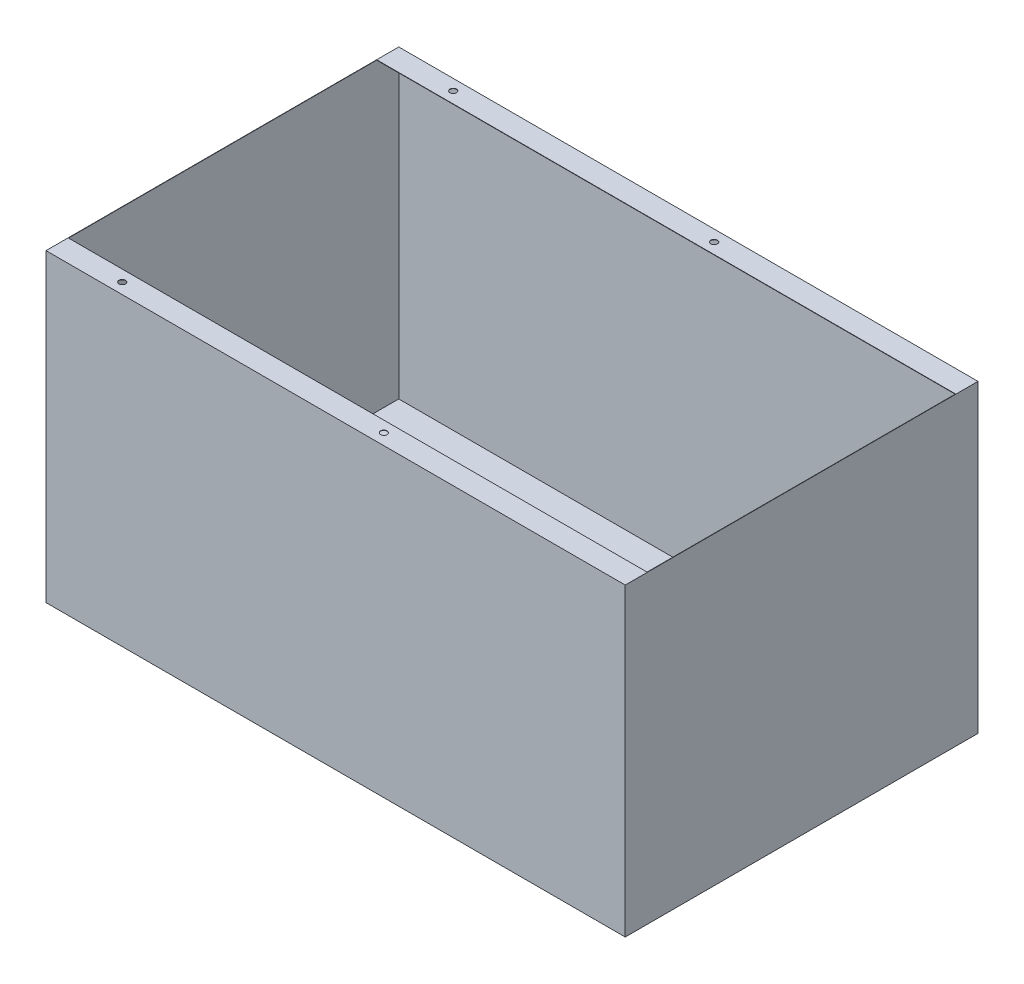
from build123d import *

# Parameters (mm, degrees)
SKETCH1_W           = 2057.4
SKETCH1_H           = 1778
BOSS_EXTRUDE1_DEPTH = 3378.2
SKETCH2_W           = 3374.19999784
SKETCH2_H           = 2053.39999784
CUT_EXTRUDE1_DEPTH  = 1775.99999892
SKETCH3_W           = 3374.19999784
SKETCH3_H           = 2.00000108
BOSS_EXTRUDE2_DEPTH = 127
SKETCH4_W           = 3374.19999784
SKETCH4_H           = 2.00000108
BOSS_EXTRUDE3_DEPTH = 127
CUT_EXTRUDE2_REACH  = 4338.636
SKETCH5_R           = 19.05
SCALE1_SCALE        = 2.54


with BuildPart() as part:
    # Sketch1 → Boss-Extrude1 (new body)
    with BuildSketch(Plane(origin=(0, 0, 0), x_dir=(0, 0, -1), z_dir=(1, 0, 0))):
        with Locations((1028.7, 889)):
            Rectangle(SKETCH1_W, SKETCH1_H)
    extrude(amount=-BOSS_EXTRUDE1_DEPTH)

    # Sketch2 → Cut-Extrude1 (cut)
    with BuildSketch(Plane(origin=(0, 1778, 0), x_dir=(1, 0, 0), z_dir=(0, 1, 0))):
        with Locations((-1689.1, 1028.7)):
            Rectangle(SKETCH2_W, SKETCH2_H)
    extrude(amount=-CUT_EXTRUDE1_DEPTH, mode=Mode.SUBTRACT)

    # Sketch3 → Boss-Extrude2 (add)
    with BuildSketch(Plane.XY.offset(-2055.39999892)):
        with Locations((-1689.1, 1776.99999946)):
            Rectangle(SKETCH3_W, SKETCH3_H)
    extrude(amount=BOSS_EXTRUDE2_DEPTH)

    # Sketch4 → Boss-Extrude3 (add)
    with BuildSketch(Plane(origin=(0, 0, -2.00000108), x_dir=(-1, 0, 0), z_dir=(0, 0, -1))):
        with Locations((1689.1, 1776.99999946)):
            Rectangle(SKETCH4_W, SKETCH4_H)
    extrude(amount=BOSS_EXTRUDE3_DEPTH)

    # Sketch5 → Cut-Extrude2 (cut, up to next)
    with BuildSketch(Plane(origin=(0, 1778, 0), x_dir=(1, 0, 0), z_dir=(0, 1, 0)), mode=Mode.PRIVATE) as cut_extrude2_sk1:
        with Locations(Location((-1473.2, 65.50000108, 0), (0, 0, 270))):
            Circle(SKETCH5_R)
    cut_extrude2_tool1 = extrude(cut_extrude2_sk1.sketch, amount=-CUT_EXTRUDE2_REACH, mode=Mode.PRIVATE) & part.part
    # Sketch5 → Cut-Extrude2 (cut, up to next)
    with BuildSketch(Plane(origin=(0, 1778, 0), x_dir=(1, 0, 0), z_dir=(0, 1, 0)), mode=Mode.PRIVATE) as cut_extrude2_sk2:
        with Locations(Location((-1473.2, 1991.89999892, 0), (0, 0, 270))):
            Circle(SKETCH5_R)
    cut_extrude2_tool2 = extrude(cut_extrude2_sk2.sketch, amount=-CUT_EXTRUDE2_REACH, mode=Mode.PRIVATE) & part.part
    # Sketch5 → Cut-Extrude2 (cut, up to next)
    with BuildSketch(Plane(origin=(0, 1778, 0), x_dir=(1, 0, 0), z_dir=(0, 1, 0)), mode=Mode.PRIVATE) as cut_extrude2_sk3:
        with Locations(Location((-2997.2, 1993.9, 0), (0, 0, 270))):
            Circle(SKETCH5_R)
    cut_extrude2_tool3 = extrude(cut_extrude2_sk3.sketch, amount=-CUT_EXTRUDE2_REACH, mode=Mode.PRIVATE) & part.part
    # Sketch5 → Cut-Extrude2 (cut, up to next)
    with BuildSketch(Plane(origin=(0, 1778, 0), x_dir=(1, 0, 0), z_dir=(0, 1, 0)), mode=Mode.PRIVATE) as cut_extrude2_sk4:
        with Locations(Location((-2997.2, 63.5, 0), (0, 0, 270))):
            Circle(SKETCH5_R)
    cut_extrude2_tool4 = extrude(cut_extrude2_sk4.sketch, amount=-CUT_EXTRUDE2_REACH, mode=Mode.PRIVATE) & part.part
    add(cut_extrude2_tool1.solids().sort_by_distance((-1473.2, 1778, -65.500001))[0], mode=Mode.SUBTRACT)
    add(cut_extrude2_tool2.solids().sort_by_distance((-1473.2, 1778, -1991.899999))[0], mode=Mode.SUBTRACT)
    add(cut_extrude2_tool3.solids().sort_by_distance((-2997.2, 1778, -1993.9))[0], mode=Mode.SUBTRACT)
    add(cut_extrude2_tool4.solids().sort_by_distance((-2997.2, 1778, -63.5))[0], mode=Mode.SUBTRACT)


with BuildPart() as part_1:
    # Scale1: scaled about (-1689.008088594, 689.870781671, -1028.7)
    add(part.part.scale(SCALE1_SCALE).moved(Location((2601.072456435, -1062.401003773, 1584.198))))


solid = part_1.part
